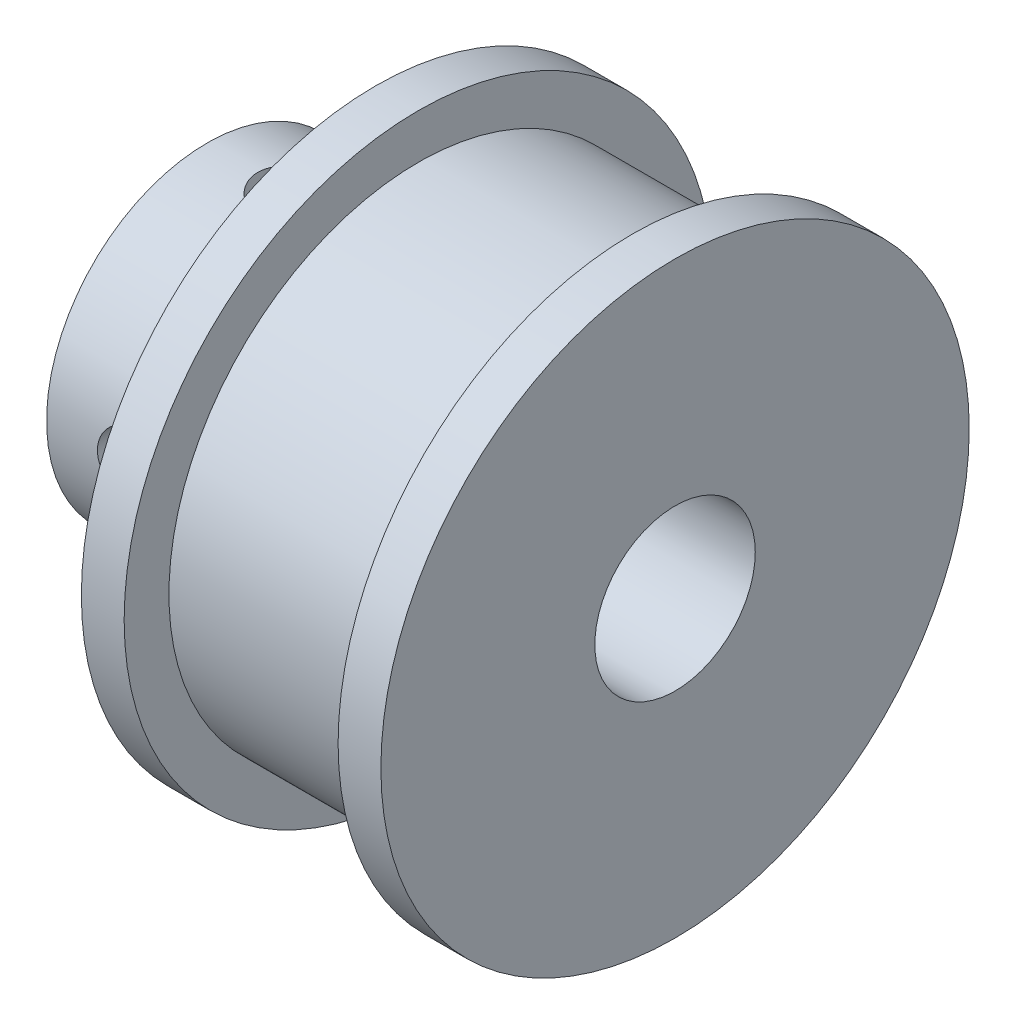
from build123d import *

# Parameters (mm, degrees)
SKETCH2_W          = 1.25
SKETCH2_H          = 11
SKETCH4_W          = 1.25
SKETCH4_H          = 11
SKETCH6_R          = 3
CUT_EXTRUDE1_DEPTH = 24.414739023


with BuildPart() as part:
    # Sketch1 → Revolve1 (revolve)
    with BuildSketch(Plane.XY, mode=Mode.PRIVATE) as revolve1_sk:
        Polygon((0, 2.5), (0, 6), (6.3, 6), (6.3, 11), (7.9, 11), (7.9, 9.325), (15.9, 9.325), (15.9, 11), (17.5, 11), (17.5, 2.5), align=None)
    revolve(revolve1_sk.sketch.rotate(Axis((0, 0, 0), (-1, 0, 0)), 90), axis=Axis((0, 0, 0), (-1, 0, 0)))

    # Sketch2 → M3x0.5 Tapped Hole1 (revolve, cut)
    with BuildSketch(Plane(origin=(3.15, 0, 0), x_dir=(0, 0, -1), z_dir=(1, 0, 0))):
        with Locations((0.625, 5.5)):
            Rectangle(SKETCH2_W, SKETCH2_H)
    revolve(axis=Axis((3.15, -6.35, 0), (0, 1, 0)), mode=Mode.SUBTRACT)

    # Sketch4 → M3x0.5 Tapped Hole2 (revolve, cut)
    with BuildSketch(Plane.YZ.offset(3.15)):
        with Locations((0.625, 5.5)):
            Rectangle(SKETCH4_W, SKETCH4_H)
    revolve(axis=Axis((3.15, 0, -6.35), (0, 0, 1)), mode=Mode.SUBTRACT)

    # Sketch6 → Cut-Extrude1 (cut, through all)
    with BuildSketch(Plane(origin=(17.5, 0, 0), x_dir=(0, 0, -1), z_dir=(1, 0, 0))):
        Circle(SKETCH6_R)
    extrude(amount=-CUT_EXTRUDE1_DEPTH, mode=Mode.SUBTRACT)


solid = part.part
